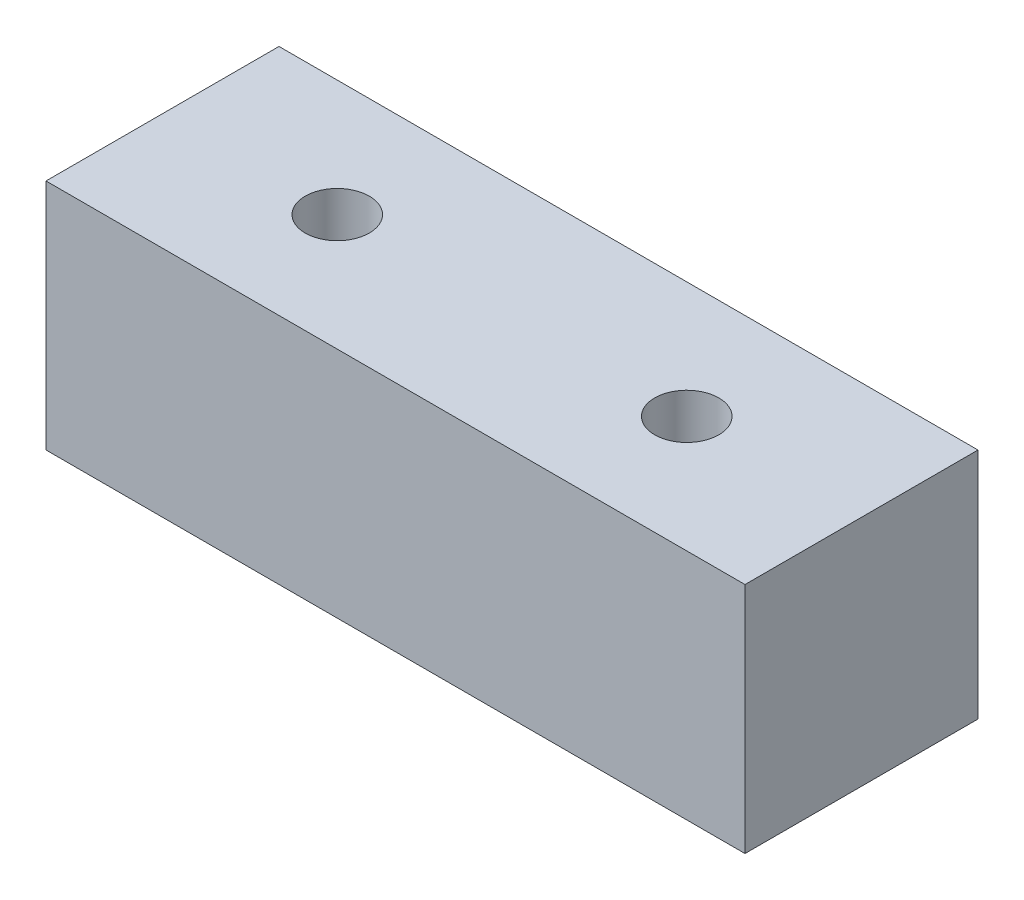
from build123d import *

# Parameters (mm, degrees)
SKETCH1_W           = 20
SKETCH1_H           = 20
BOSS_EXTRUDE1_DEPTH = 30
SKETCH2_R           = 2.75
CUT_EXTRUDE1_DEPTH  = 38.416573868


with BuildPart() as part:
    # Sketch1 → Boss-Extrude1 (new, symmetric)
    with BuildSketch(Plane(origin=(0, 0, 0), x_dir=(0, 0, -1), z_dir=(1, 0, 0))):
        Rectangle(SKETCH1_W, SKETCH1_H)
    extrude(amount=BOSS_EXTRUDE1_DEPTH, both=True)

    # Sketch2 → Cut-Extrude1 (cut, through all)
    with BuildSketch(Plane(origin=(0, 10, 0), x_dir=(1, 0, 0), z_dir=(0, 1, 0))):
        with Locations(Location((15, 0, 0), (0, 0, 270))):
            Circle(SKETCH2_R)
    cut_extrude1 = extrude(amount=-CUT_EXTRUDE1_DEPTH, mode=Mode.SUBTRACT)

    # Mirror1: Cut-Extrude1 across plane
    add(cut_extrude1.mirror(Plane(origin=(0, 0, 0), x_dir=(0, 0, 1), z_dir=(1, 0, 0))), mode=Mode.SUBTRACT)


solid = part.part
